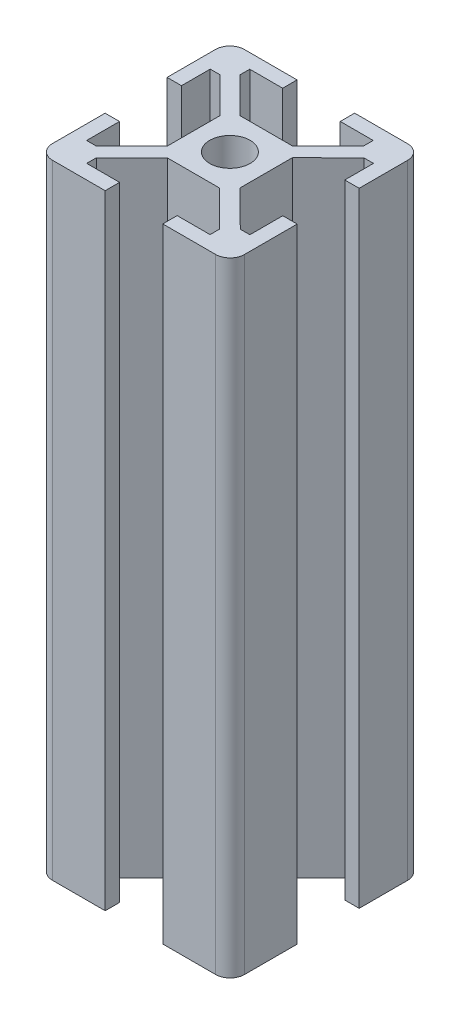
from build123d import *

# Parameters (mm, degrees)
SKETCH1_R           = 2.1
BOSS_EXTRUDE1_DEPTH = 65
FILLET1_R           = 1.5


with BuildPart() as part:
    # Sketch1 → Boss-Extrude1 (new body)
    with BuildSketch(Plane(origin=(0, 0, 0), x_dir=(1, 0, 0), z_dir=(0, 1, 0))):
        Polygon((0, 0), (7, 0), (7, 1.5), (3.56901309, 1.5), (3.56901309, 2.5), (7.26901309, 6.2), (12.73098691, 6.2), (16.43098691, 2.5), (16.43098691, 1.5), (13, 1.5), (13, 0), (20.018554527, 0), (20.018554527, 6.993482935), (18.518554527, 6.993482935), (18.518554527, 3.562496025), (17.518554527, 3.562496025), (13.777987766, 7.26901309), (13.777987766, 12.73098691), (17.518554527, 16.447701982), (18.518554527, 16.447701982), (18.518554527, 13.45318801), (20.018554527, 13.45318801), (20.018554527, 20), (13, 20), (13, 18.5), (16.43098691, 18.5), (16.43098691, 17.5), (12.73098691, 13.795754461), (7.26901309, 13.795754461), (3.56901309, 17.5), (3.56901309, 18.5), (7, 18.5), (7, 20), (0, 20), (0, 13.45318801), (1.5, 13.45318801), (1.5, 16.447701982), (2.5, 16.447701982), (6.209487856, 12.733957701), (6.209487856, 7.271983881), (2.5, 3.562496025), (1.5, 3.562496025), (1.5, 6.993482935), (0, 6.993482935), align=None)
        with Locations(Location((10, 10, 0), (0, 0, 270))):
            Circle(SKETCH1_R, mode=Mode.SUBTRACT)
    extrude(amount=BOSS_EXTRUDE1_DEPTH)

    # Fillet1
    fillet1_edges = [part.edges().sort_by_distance(p)[0] for p in [
        (0, 32.5, -20),
        (20.018554527, 32.5, -20),
        (20.018554527, 32.5, 0),
        (0, 32.5, 0),
    ]]
    fillet(fillet1_edges, radius=FILLET1_R)


solid = part.part
